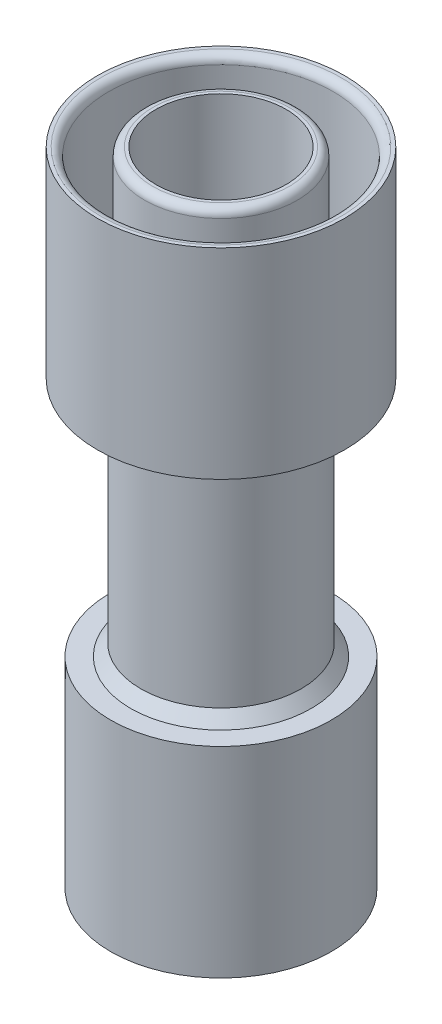
from build123d import *

# Parameters (mm, degrees)
SKETCH2_R          = 11.18
SKETCH2_R_2        = 7.615
CUT_EXTRUDE1_DEPTH = 18
FILLET1_R          = 0.8


with BuildPart() as part:
    # Sketch1 → Revolve1 (revolve)
    with BuildSketch(Plane(origin=(0, 0, 0), x_dir=(0, 0, -1), z_dir=(1, 0, 0)), mode=Mode.PRIVATE) as revolve1_sk:
        with BuildLine():
            Line((12.33, 64), (12.33, 44))
            Line((12.33, 44), (10, 44))
            ThreePointArc((10, 44), (8.585786438, 43.414213562), (8, 42))
            Line((8, 42), (8, 21.197712361))
            Line((8, 21.197712361), (9.005, 20))
            Line((9.005, 20), (11.005, 20))
            Line((11.005, 20), (11.005, 0))
            Line((11.005, 0), (7.73, 0))
            Line((7.73, 0), (7.73, 16))
            Line((7.73, 16), (6.5, 17.465856919))
            Line((6.5, 17.465856919), (6.5, 25.465856919))
            Line((6.5, 25.465856919), (4.5, 29.465856919))
            Line((4.5, 29.465856919), (4.5, 37.465856919))
            Line((4.5, 37.465856919), (6.5, 45.465856919))
            Line((6.5, 45.465856919), (6.5, 64))
            Line((6.5, 64), (12.33, 64))
        make_face()
    revolve(revolve1_sk.sketch.rotate(Axis((0, 34.050123762, 0), (0, -1, 0)), 180), axis=Axis((0, 34.050123762, 0), (0, -1, 0)))

    # Sketch2 → Cut-Extrude1 (cut)
    with BuildSketch(Plane(origin=(0, 64, 0), x_dir=(1, 0, 0), z_dir=(0, 1, 0))):
        with Locations(Location((0, 0, 0), (0, 0, 270))):
            Circle(SKETCH2_R)
        with Locations(Location((0, 0, 0), (0, 0, 270))):
            Circle(SKETCH2_R_2, mode=Mode.SUBTRACT)
    extrude(amount=-CUT_EXTRUDE1_DEPTH, mode=Mode.SUBTRACT)

    # Fillet1
    fillet1_edges = [part.edges().sort_by_distance(p)[0] for p in [
        (0, 64, -11.18),
        (0, 64, -7.615),
    ]]
    fillet(fillet1_edges, radius=FILLET1_R)


solid = part.part
